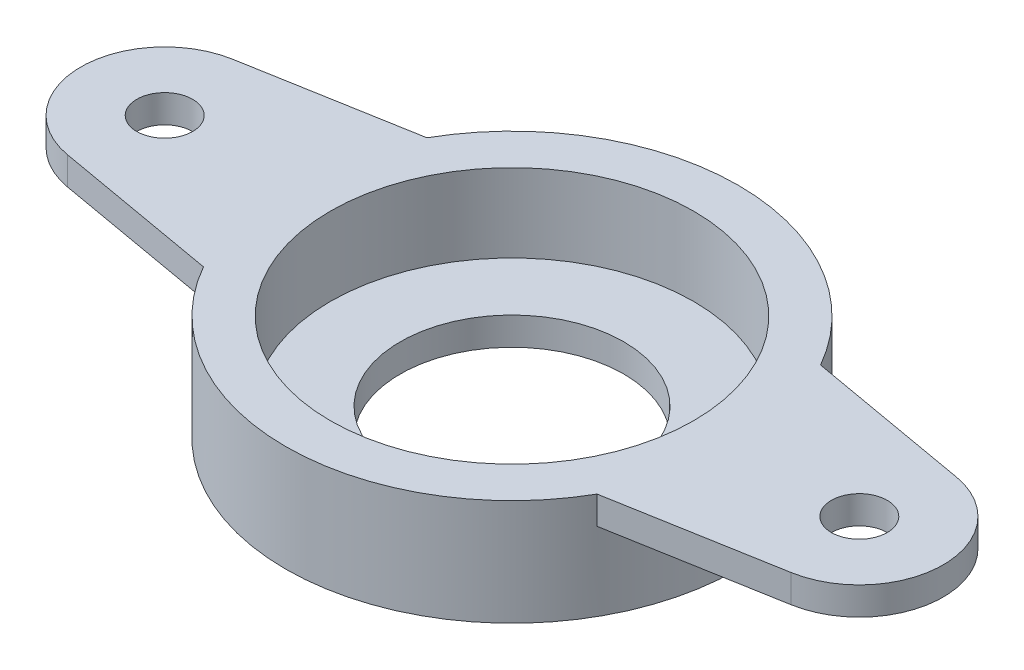
from build123d import *

# Parameters (mm, degrees)
SKETCH1_R           = 25.7175
SKETCH1_R_2         = 20.6375
BOSS_EXTRUDE1_DEPTH = 8.89
BOSS_EXTRUDE2_START = 3.175
SKETCH2_R           = 25.7175
SKETCH2_R_2         = 12.7
BOSS_EXTRUDE2_DEPTH = 3.175
BOSS_EXTRUDE3_START = -3.175
SKETCH3_R           = 3.175
BOSS_EXTRUDE3_DEPTH = 3.175


with BuildPart() as part:
    # Sketch1 → Boss-Extrude1 (new body)
    with BuildSketch(Plane(origin=(0, 0, 0), x_dir=(1, 0, 0), z_dir=(0, 1, 0))):
        with Locations(Location((0, 0, 0), (0, 0, 270))):
            Circle(SKETCH1_R)
        with Locations(Location((0, 0, 0), (0, 0, 270))):
            Circle(SKETCH1_R_2, mode=Mode.SUBTRACT)
    extrude(amount=BOSS_EXTRUDE1_DEPTH)

    # Sketch2 → Boss-Extrude2 (add)
    with BuildSketch(Plane.XZ.offset(BOSS_EXTRUDE2_START)):
        with Locations(Location((0, 0, 0), (0, 0, 270))):
            Circle(SKETCH2_R)
        with Locations(Location((0, 0, 0), (0, 0, 270))):
            Circle(SKETCH2_R_2, mode=Mode.SUBTRACT)
    extrude(amount=-BOSS_EXTRUDE2_DEPTH)

    # Sketch3 → Boss-Extrude3 (add)
    # profile 1 of 2: a face of its own
    with BuildSketch(Plane(origin=(0, 8.89, 0), x_dir=(1, 0, 0), z_dir=(0, 1, 0)).offset(BOSS_EXTRUDE3_START)):
        with BuildLine():
            Line((22.362911399, 12.7), (41.123499094, 9.392002215))
            ThreePointArc((41.123499094, 9.392002215), (49.004324689, 0), (41.123499094, -9.392002215))
            Line((41.123499094, -9.392002215), (22.362911399, -12.7))
            ThreePointArc((22.362911399, -12.7), (25.7175, 0), (22.362911399, 12.7))
        make_face()
        with Locations(Location((39.467435701, 0, 0), (0, 0, 270))):
            Circle(SKETCH3_R, mode=Mode.SUBTRACT)
    # profile 2 of 2: a face of its own
    with BuildSketch(Plane(origin=(0, 8.89, 0), x_dir=(1, 0, 0), z_dir=(0, 1, 0)).offset(BOSS_EXTRUDE3_START)):
        with BuildLine():
            Line((-22.362911399, -12.7), (-41.123499094, -9.392002215))
            ThreePointArc((-41.123499094, -9.392002215), (-49.004324689, 0), (-41.123499094, 9.392002215))
            Line((-41.123499094, 9.392002215), (-22.362911399, 12.7))
            ThreePointArc((-22.362911399, 12.7), (-25.7175, 0), (-22.362911399, -12.7))
        make_face()
        with Locations(Location((-39.467435701, 0, 0), (0, 0, 90))):
            Circle(SKETCH3_R, mode=Mode.SUBTRACT)
    extrude(amount=BOSS_EXTRUDE3_DEPTH)


solid = part.part
